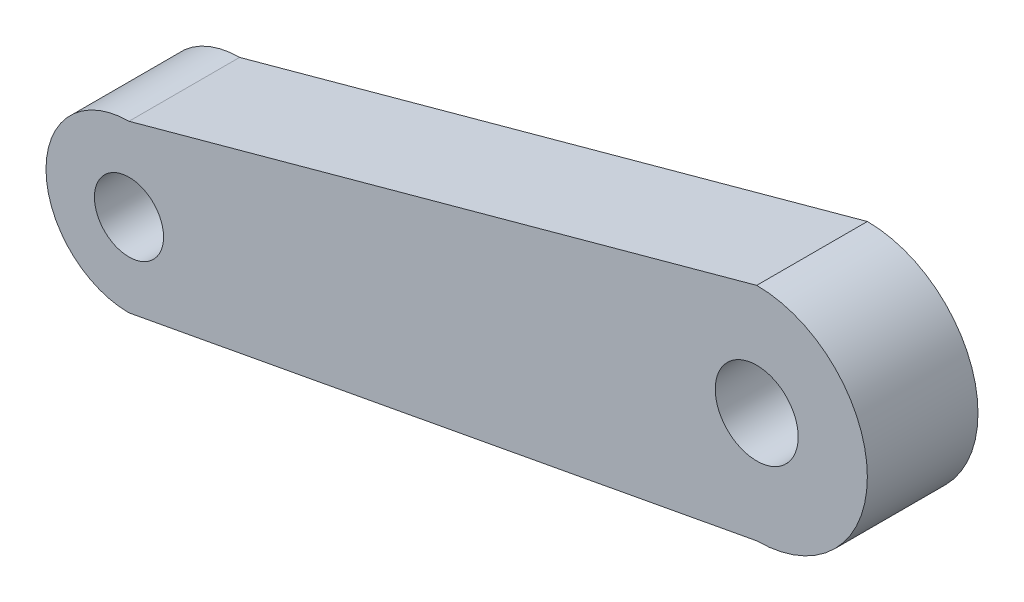
from build123d import *

# Parameters (mm, degrees)
SKETCH_1_R      = 3
SKETCH_1_R_2    = 2.5
EXTRUDE_1_DEPTH = 8


with BuildPart() as part:
    # Эскиз1 → Вытянуть1 (new body)
    with BuildSketch(Plane.XY):
        with BuildLine():
            Line((-33.293945803, -2.67996555), (12.097120792, 9.739818876))
            ThreePointArc((12.097120792, 9.739818876), (20.097120792, 1.739818876), (12.097120792, -6.260181124))
            Line((12.097120792, -6.260181124), (-33.293945803, -14.67996555))
            ThreePointArc((-33.293945803, -14.67996555), (-39.293945803, -8.67996555), (-33.293945803, -2.67996555))
        make_face()
        with Locations((12.097120792, 1.739818876)):
            Circle(SKETCH_1_R, mode=Mode.SUBTRACT)
        with Locations((-33.293945803, -8.67996555)):
            Circle(SKETCH_1_R_2, mode=Mode.SUBTRACT)
    extrude(amount=EXTRUDE_1_DEPTH)


solid = part.part
